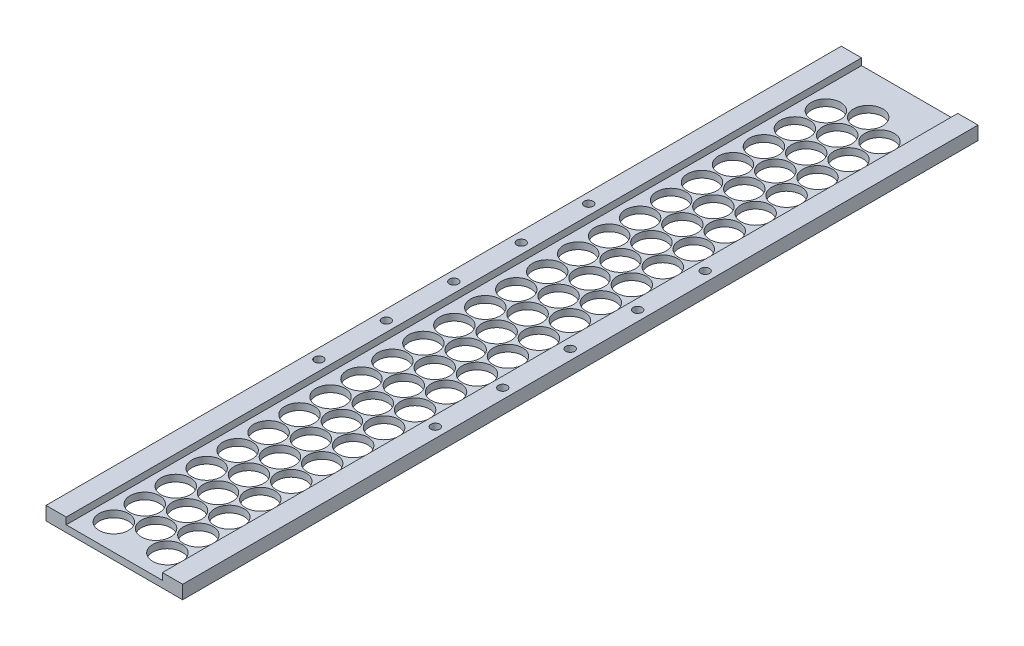
from build123d import *

# Parameters (mm, degrees)
CELL_BLOCK_SKETCH_W = 71.300566034
CELL_BLOCK_SKETCH_H = 589.575
BOSS_EXTRUDE1_DEPTH = 5
SKETCH1_R           = 10.875
CUT_EXTRUDE2_DEPTH  = 5
SKETCH3_W           = 15
SKETCH3_H           = 589.575
BOSS_EXTRUDE3_DEPTH = 10
SKETCH4_R           = 3.25
CUT_EXTRUDE3_DEPTH  = 10


with BuildPart() as part:
    # Cell Block Sketch → Boss-Extrude1 (new body)
    with BuildSketch(Plane(origin=(0, 0, 0), x_dir=(1, 0, 0), z_dir=(0, 1, 0))):
        Rectangle(CELL_BLOCK_SKETCH_W, CELL_BLOCK_SKETCH_H)
    extrude(amount=BOSS_EXTRUDE1_DEPTH)

    # Sketch1 → Cut-Extrude2 (cut)
    with BuildSketch(Plane(origin=(0, 5, 0), x_dir=(1, 0, 0), z_dir=(0, 1, 0))):
        with Locations(Location((-19.875283017, 252.5375, 0), (0, 0, 270))):
            Circle(SKETCH1_R)
        with Locations(Location((0, 264.0125, 0), (0, 0, 270))):
            Circle(SKETCH1_R)
        with Locations(Location((19.875283017, 252.5375, 0), (0, 0, 270))):
            Circle(SKETCH1_R)
        with Locations(Location((-19.875283017, 229.5875, 0), (0, 0, 270))):
            Circle(SKETCH1_R)
        with Locations(Location((0, 241.0625, 0), (0, 0, 270))):
            Circle(SKETCH1_R)
        with Locations(Location((19.875283017, 229.5875, 0), (0, 0, 270))):
            Circle(SKETCH1_R)
        with Locations(Location((-19.875283017, 206.6375, 0), (0, 0, 270))):
            Circle(SKETCH1_R)
        with Locations(Location((0, 218.1125, 0), (0, 0, 270))):
            Circle(SKETCH1_R)
        with Locations(Location((19.875283017, 206.6375, 0), (0, 0, 270))):
            Circle(SKETCH1_R)
        with Locations(Location((-19.875283017, 183.6875, 0), (0, 0, 270))):
            Circle(SKETCH1_R)
        with Locations(Location((0, 195.1625, 0), (0, 0, 270))):
            Circle(SKETCH1_R)
        with Locations(Location((19.875283017, 183.6875, 0), (0, 0, 270))):
            Circle(SKETCH1_R)
        with Locations(Location((-19.875283017, 160.7375, 0), (0, 0, 270))):
            Circle(SKETCH1_R)
        with Locations(Location((0, 172.2125, 0), (0, 0, 270))):
            Circle(SKETCH1_R)
        with Locations(Location((19.875283017, 160.7375, 0), (0, 0, 270))):
            Circle(SKETCH1_R)
        with Locations(Location((-19.875283017, 137.7875, 0), (0, 0, 270))):
            Circle(SKETCH1_R)
        with Locations(Location((0, 149.2625, 0), (0, 0, 270))):
            Circle(SKETCH1_R)
        with Locations(Location((19.875283017, 137.7875, 0), (0, 0, 270))):
            Circle(SKETCH1_R)
        with Locations(Location((-19.875283017, 114.8375, 0), (0, 0, 270))):
            Circle(SKETCH1_R)
        with Locations(Location((0, 126.3125, 0), (0, 0, 270))):
            Circle(SKETCH1_R)
        with Locations(Location((19.875283017, 114.8375, 0), (0, 0, 270))):
            Circle(SKETCH1_R)
        with Locations(Location((-19.875283017, 91.8875, 0), (0, 0, 270))):
            Circle(SKETCH1_R)
        with Locations(Location((0, 103.3625, 0), (0, 0, 270))):
            Circle(SKETCH1_R)
        with Locations(Location((19.875283017, 91.8875, 0), (0, 0, 270))):
            Circle(SKETCH1_R)
        with Locations(Location((-19.875283017, 68.9375, 0), (0, 0, 270))):
            Circle(SKETCH1_R)
        with Locations(Location((0, 80.4125, 0), (0, 0, 270))):
            Circle(SKETCH1_R)
        with Locations(Location((19.875283017, 68.9375, 0), (0, 0, 270))):
            Circle(SKETCH1_R)
        with Locations(Location((-19.875283017, 45.9875, 0), (0, 0, 270))):
            Circle(SKETCH1_R)
        with Locations(Location((0, 57.4625, 0), (0, 0, 270))):
            Circle(SKETCH1_R)
        with Locations(Location((19.875283017, 45.9875, 0), (0, 0, 270))):
            Circle(SKETCH1_R)
        with Locations(Location((-19.875283017, 23.0375, 0), (0, 0, 270))):
            Circle(SKETCH1_R)
        with Locations(Location((0, 34.5125, 0), (0, 0, 270))):
            Circle(SKETCH1_R)
        with Locations(Location((19.875283017, 23.0375, 0), (0, 0, 270))):
            Circle(SKETCH1_R)
        with Locations(Location((-19.875283017, 0.0875, 0), (0, 0, 270))):
            Circle(SKETCH1_R)
        with Locations(Location((0, 11.5625, 0), (0, 0, 270))):
            Circle(SKETCH1_R)
        with Locations(Location((19.875283017, 0.0875, 0), (0, 0, 270))):
            Circle(SKETCH1_R)
        with Locations(Location((-19.875283017, -22.8625, 0), (0, 0, 270))):
            Circle(SKETCH1_R)
        with Locations(Location((0, -11.3875, 0), (0, 0, 270))):
            Circle(SKETCH1_R)
        with Locations(Location((19.875283017, -22.8625, 0), (0, 0, 270))):
            Circle(SKETCH1_R)
        with Locations(Location((-19.875283017, -45.8125, 0), (0, 0, 270))):
            Circle(SKETCH1_R)
        with Locations(Location((0, -34.3375, 0), (0, 0, 270))):
            Circle(SKETCH1_R)
        with Locations(Location((19.875283017, -45.8125, 0), (0, 0, 270))):
            Circle(SKETCH1_R)
        with Locations(Location((-19.875283017, -68.7625, 0), (0, 0, 270))):
            Circle(SKETCH1_R)
        with Locations(Location((0, -57.2875, 0), (0, 0, 270))):
            Circle(SKETCH1_R)
        with Locations(Location((19.875283017, -68.7625, 0), (0, 0, 270))):
            Circle(SKETCH1_R)
        with Locations(Location((-19.875283017, -91.7125, 0), (0, 0, 270))):
            Circle(SKETCH1_R)
        with Locations(Location((0, -80.2375, 0), (0, 0, 270))):
            Circle(SKETCH1_R)
        with Locations(Location((19.875283017, -91.7125, 0), (0, 0, 270))):
            Circle(SKETCH1_R)
        with Locations(Location((-19.875283017, -114.6625, 0), (0, 0, 270))):
            Circle(SKETCH1_R)
        with Locations(Location((0, -103.1875, 0), (0, 0, 270))):
            Circle(SKETCH1_R)
        with Locations(Location((19.875283017, -114.6625, 0), (0, 0, 270))):
            Circle(SKETCH1_R)
        with Locations(Location((-19.875283017, -137.6125, 0), (0, 0, 270))):
            Circle(SKETCH1_R)
        with Locations(Location((0, -126.1375, 0), (0, 0, 270))):
            Circle(SKETCH1_R)
        with Locations(Location((19.875283017, -137.6125, 0), (0, 0, 270))):
            Circle(SKETCH1_R)
        with Locations(Location((-19.875283017, -160.5625, 0), (0, 0, 270))):
            Circle(SKETCH1_R)
        with Locations(Location((0, -149.0875, 0), (0, 0, 270))):
            Circle(SKETCH1_R)
        with Locations(Location((19.875283017, -160.5625, 0), (0, 0, 270))):
            Circle(SKETCH1_R)
        with Locations(Location((-19.875283017, -183.5125, 0), (0, 0, 270))):
            Circle(SKETCH1_R)
        with Locations(Location((0, -172.0375, 0), (0, 0, 270))):
            Circle(SKETCH1_R)
        with Locations(Location((19.875283017, -183.5125, 0), (0, 0, 270))):
            Circle(SKETCH1_R)
        with Locations(Location((-19.875283017, -206.4625, 0), (0, 0, 270))):
            Circle(SKETCH1_R)
        with Locations(Location((0, -194.9875, 0), (0, 0, 270))):
            Circle(SKETCH1_R)
        with Locations(Location((19.875283017, -206.4625, 0), (0, 0, 270))):
            Circle(SKETCH1_R)
        with Locations(Location((-19.875283017, -229.4125, 0), (0, 0, 270))):
            Circle(SKETCH1_R)
        with Locations(Location((0, -217.9375, 0), (0, 0, 270))):
            Circle(SKETCH1_R)
        with Locations(Location((19.875283017, -229.4125, 0), (0, 0, 270))):
            Circle(SKETCH1_R)
        with Locations(Location((-19.875283017, -252.3625, 0), (0, 0, 270))):
            Circle(SKETCH1_R)
        with Locations(Location((0, -240.8875, 0), (0, 0, 270))):
            Circle(SKETCH1_R)
        with Locations(Location((19.875283017, -252.3625, 0), (0, 0, 270))):
            Circle(SKETCH1_R)
        with Locations(Location((-19.875283017, -275.3125, 0), (0, 0, 270))):
            Circle(SKETCH1_R)
        with Locations(Location((0, -263.8375, 0), (0, 0, 270))):
            Circle(SKETCH1_R)
        with Locations(Location((19.875283017, -275.3125, 0), (0, 0, 270))):
            Circle(SKETCH1_R)
    extrude(amount=-CUT_EXTRUDE2_DEPTH, mode=Mode.SUBTRACT)

    # Sketch3 → Boss-Extrude3 (add)
    with BuildSketch(Plane(origin=(0, 0, 0), x_dir=(1, 0, 0), z_dir=(0, 1, 0))):
        with Locations((-43.150283017, 0)):
            Rectangle(SKETCH3_W, SKETCH3_H)
    boss_extrude3 = extrude(amount=BOSS_EXTRUDE3_DEPTH)

    # Mirror1: Boss-Extrude3 across plane
    add(boss_extrude3.mirror(Plane(origin=(0, 0, 0), x_dir=(0, 0, 1), z_dir=(1, 0, 0))))

    # Sketch4 → Cut-Extrude3 (cut)
    with BuildSketch(Plane(origin=(0, 10, 0), x_dir=(1, 0, 0), z_dir=(0, 1, 0))):
        with Locations(Location((-43.150283017, 0, 0), (0, 0, 270))):
            Circle(SKETCH4_R)
        with Locations(Location((-43.150283017, -50, 0), (0, 0, 270))):
            Circle(SKETCH4_R)
        with Locations(Location((-43.150283017, -100, 0), (0, 0, 270))):
            Circle(SKETCH4_R)
        with Locations(Location((-43.150283017, 50, 0), (0, 0, 270))):
            Circle(SKETCH4_R)
        with Locations(Location((-43.150283017, 100, 0), (0, 0, 270))):
            Circle(SKETCH4_R)
    cut_extrude3 = extrude(amount=-CUT_EXTRUDE3_DEPTH, mode=Mode.SUBTRACT)

    # Mirror2: Cut-Extrude3 across plane
    add(cut_extrude3.mirror(Plane(origin=(0, 0, 0), x_dir=(0, 0, 1), z_dir=(1, 0, 0))), mode=Mode.SUBTRACT)


solid = part.part
